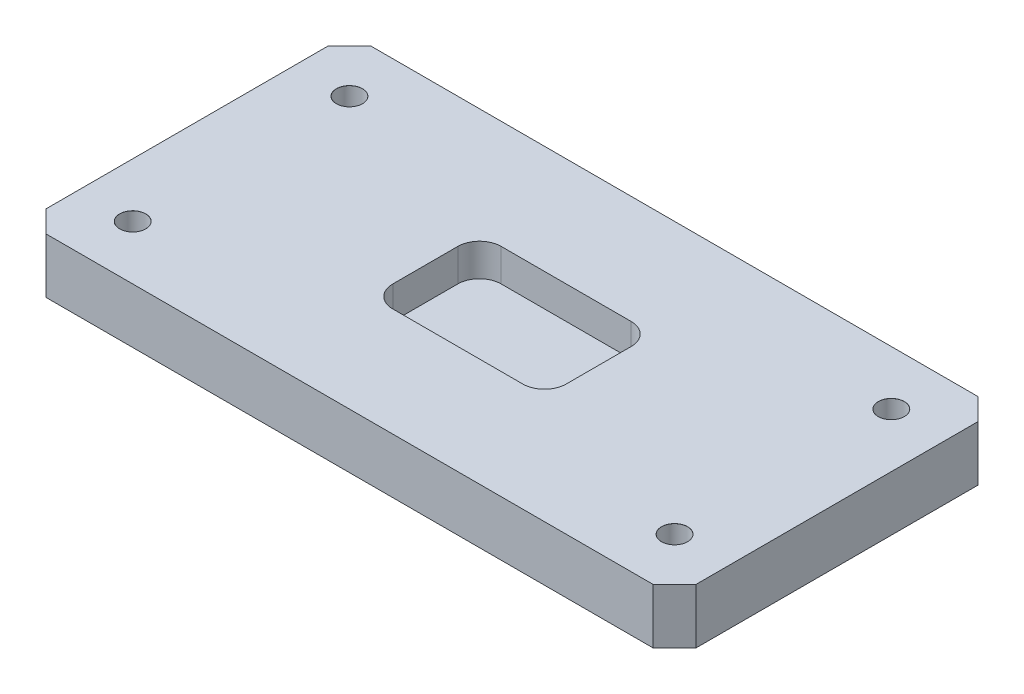
from build123d import *

# Parameters (mm, degrees)
BOSS_EXTRUDE1_DEPTH              = 25.4
SKETCH4_W                        = 80
SKETCH4_H                        = 50
CUT_EXTRUDE1_DEPTH               = 15
FILLET1_R                        = 10
F_12_0MM_DOWEL_HOLE1_D           = 12
F_12_0MM_DOWEL_HOLE1_CSINK_D     = 12.05
F_12_0MM_DOWEL_HOLE1_CSINK_ANGLE = 100


with BuildPart() as part:
    # Sketch1 → Boss-Extrude1 (new body)
    with BuildSketch(Plane(origin=(0, 0, 0), x_dir=(1, 0, 0), z_dir=(0, 1, 0))):
        Polygon((-150, 65), (-140, 75), (140, 75), (150, 65), (150, -65), (140, -75), (-140, -75), (-150, -65), align=None)
    extrude(amount=BOSS_EXTRUDE1_DEPTH)

    # Sketch4 → Cut-Extrude1 (cut)
    with BuildSketch(Plane(origin=(0, 25.4, 0), x_dir=(1, 0, 0), z_dir=(0, 1, 0))):
        Rectangle(SKETCH4_W, SKETCH4_H)
    extrude(amount=-CUT_EXTRUDE1_DEPTH, mode=Mode.SUBTRACT)

    # Fillet1
    fillet1_edges = [part.edges().sort_by_distance(p)[0] for p in [
        (-40, 17.9, 25),
        (40, 17.9, 25),
        (-40, 17.9, -25),
        (40, 17.9, -25),
    ]]
    fillet(fillet1_edges, radius=FILLET1_R)

    # Ø12.0mm Dowel Hole1 (through all)
    with Locations(Plane(origin=(0, 25.4, 0), x_dir=(1, 0, 0), z_dir=(0, 1, 0))):
        with Locations((-125, 50), (125, 50), (125, -50), (-125, -50)):
            CounterSinkHole(F_12_0MM_DOWEL_HOLE1_D / 2, F_12_0MM_DOWEL_HOLE1_CSINK_D / 2, counter_sink_angle=F_12_0MM_DOWEL_HOLE1_CSINK_ANGLE)


solid = part.part
